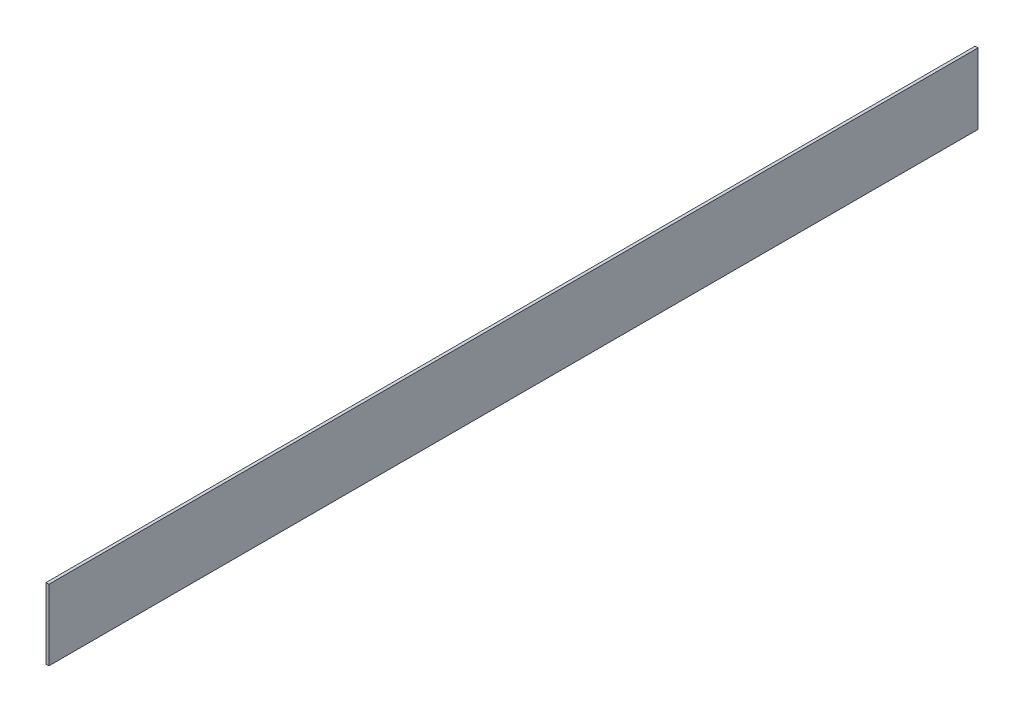
from build123d import *

# Parameters (mm, degrees)
SKETCH1_W           = 999.999999996
SKETCH1_H           = 76.073
BOSS_EXTRUDE1_DEPTH = 3.175


with BuildPart() as part:
    # Sketch1 → Boss-Extrude1 (new body)
    with BuildSketch(Plane(origin=(0, 0, 0), x_dir=(0, 0, -1), z_dir=(1, 0, 0))):
        with Locations((499.999999998, -38.0365)):
            Rectangle(SKETCH1_W, SKETCH1_H)
    extrude(amount=BOSS_EXTRUDE1_DEPTH)


solid = part.part
